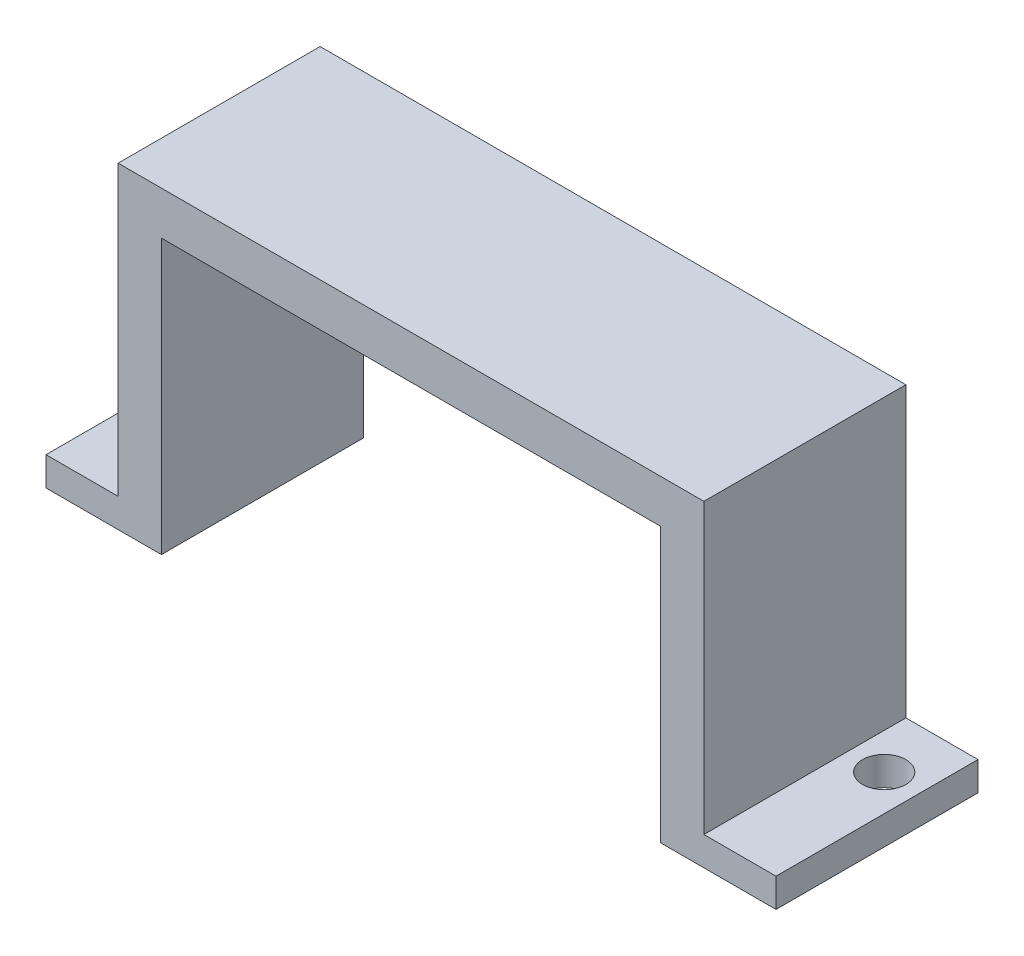
from build123d import *

# Parameters (mm, degrees)
BOSS_EXTRUDE1_DEPTH      = 14
F_3_0_3_DIAMETER_HOLE1_D = 3


with BuildPart() as part:
    # Sketch2 → Boss-Extrude1 (new body)
    with BuildSketch(Plane.XY):
        Polygon((11.93, -3.38), (16.93, -3.38), (16.93, -1.38), (11.93, -1.38), (11.93, 18.62), (-28.67, 18.62), (-28.67, -1.38), (-33.67, -1.38), (-33.67, -3.38), (-12.23, -3.38), (-25.67, -3.38), (-25.67, 15.62), (8.93, 15.62), (8.93, -3.38), align=None)
    extrude(amount=BOSS_EXTRUDE1_DEPTH)

    # Ø3.0 (3) Diameter Hole1 (through all)
    with Locations(Plane(origin=(0, -1.38, 0), x_dir=(1, 0, 0), z_dir=(0, 1, 0))):
        with Locations((14.43, -4), (-31.17, -4)):
            Hole(F_3_0_3_DIAMETER_HOLE1_D / 2)


solid = part.part
